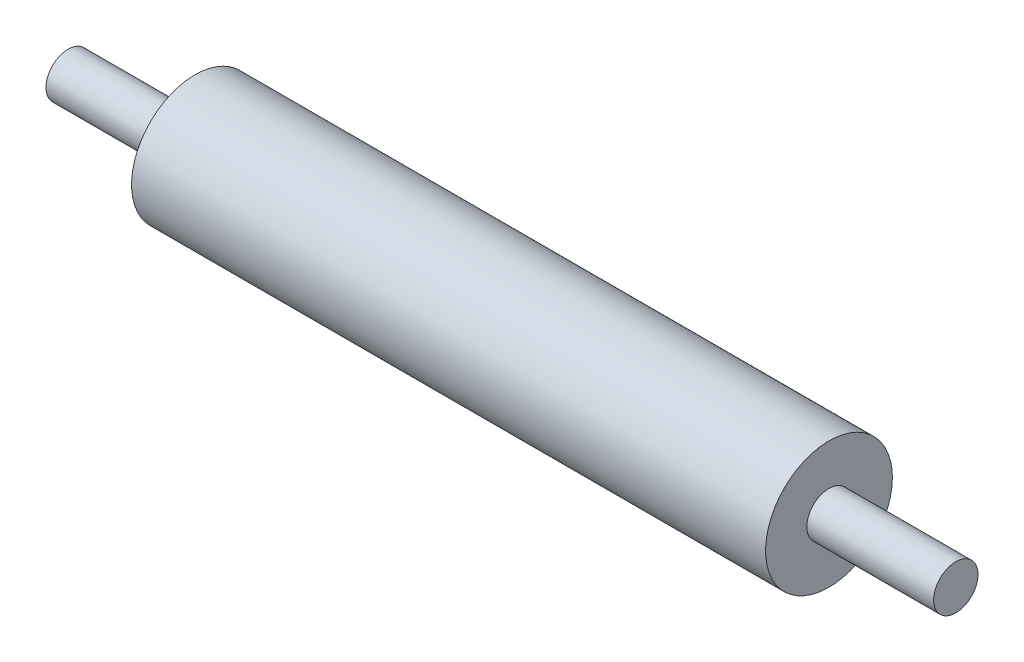
from build123d import *

# Parameters (mm, degrees)
SKETCH1_R           = 10
BOSS_EXTRUDE1_DEPTH = 50
SKETCH2_R           = 3.5
BOSS_EXTRUDE2_DEPTH = 20


with BuildPart() as part:
    # Sketch1 → Boss-Extrude1 (new, symmetric)
    with BuildSketch(Plane(origin=(0, 0, 0), x_dir=(0, 0, -1), z_dir=(1, 0, 0))):
        Circle(SKETCH1_R)
    extrude(amount=BOSS_EXTRUDE1_DEPTH, both=True)

    # Sketch2 → Boss-Extrude2 (add)
    with BuildSketch(Plane(origin=(50, 0, 0), x_dir=(0, 0, -1), z_dir=(1, 0, 0))):
        Circle(SKETCH2_R)
    boss_extrude2 = extrude(amount=BOSS_EXTRUDE2_DEPTH)

    # Mirror1: Boss-Extrude2 across plane
    add(boss_extrude2.mirror(Plane(origin=(0, 0, 0), x_dir=(0, 0, 1), z_dir=(1, 0, 0))))


solid = part.part
